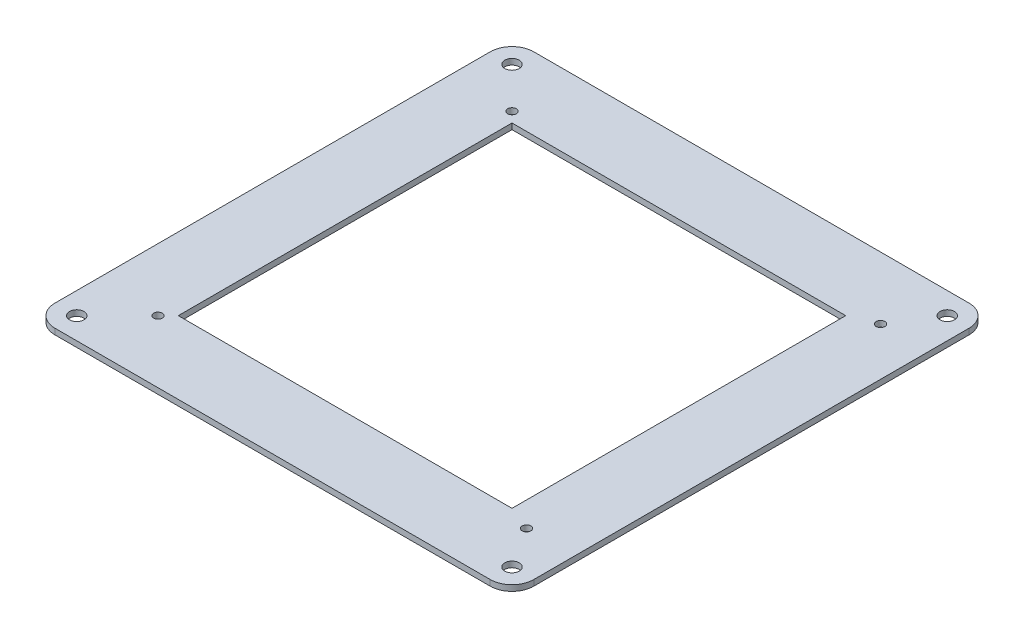
from build123d import *

# Parameters (mm, degrees)
CROQUIS1_W              = 170
CROQUIS1_H              = 170
CROQUIS1_R              = 2.5
CROQUIS1_R_2            = 1.5
CROQUIS1_W_2            = 115
CROQUIS1_H_2            = 115
SALIENTE_EXTRUIR1_DEPTH = 2
CROQUIS3_W              = 170
CROQUIS3_H              = 170
CORTAR_EXTRUIR1_DEPTH   = 10


with BuildPart() as part:
    # Croquis1 → Saliente-Extruir1 (new body)
    with BuildSketch(Plane(origin=(0, 0, 0), x_dir=(1, 0, 0), z_dir=(0, 1, 0))):
        Rectangle(CROQUIS1_W, CROQUIS1_H)
        with Locations(Location((-75, 75, 0), (0, 0, 270))):
            Circle(CROQUIS1_R, mode=Mode.SUBTRACT)
        with Locations(Location((75, 75, 0), (0, 0, 270))):
            Circle(CROQUIS1_R, mode=Mode.SUBTRACT)
        with Locations(Location((75, -75, 0), (0, 0, 270))):
            Circle(CROQUIS1_R, mode=Mode.SUBTRACT)
        with Locations(Location((-75, -75, 0), (0, 0, 270))):
            Circle(CROQUIS1_R, mode=Mode.SUBTRACT)
        with Locations(Location((-61, 61, 0), (0, 0, 270))):
            Circle(CROQUIS1_R_2, mode=Mode.SUBTRACT)
        with Locations(Location((66, 61, 0), (0, 0, 270))):
            Circle(CROQUIS1_R_2, mode=Mode.SUBTRACT)
        with Locations(Location((66, -61, 0), (0, 0, 270))):
            Circle(CROQUIS1_R_2, mode=Mode.SUBTRACT)
        with Locations(Location((-61, -61, 0), (0, 0, 270))):
            Circle(CROQUIS1_R_2, mode=Mode.SUBTRACT)
        Rectangle(CROQUIS1_W_2, CROQUIS1_H_2, mode=Mode.SUBTRACT)
    extrude(amount=SALIENTE_EXTRUIR1_DEPTH)

    # Croquis3 → Cortar-Extruir1 (cut)
    with BuildSketch(Plane(origin=(0, 2, 0), x_dir=(1, 0, 0), z_dir=(0, 1, 0))):
        Rectangle(CROQUIS3_W, CROQUIS3_H)
        with BuildLine():
            Line((75, -82.5), (-75, -82.5))
            ThreePointArc((-75, -82.5), (-80.303300859, -80.303300859), (-82.5, -75))
            Line((-82.5, -75), (-82.5, 75))
            ThreePointArc((-82.5, 75), (-80.303300859, 80.303300859), (-75, 82.5))
            Line((-75, 82.5), (75, 82.5))
            ThreePointArc((75, 82.5), (80.303300859, 80.303300859), (82.5, 75))
            Line((82.5, 75), (82.5, -75))
            ThreePointArc((82.5, -75), (80.303300859, -80.303300859), (75, -82.5))
        make_face(mode=Mode.SUBTRACT)
    extrude(amount=-CORTAR_EXTRUIR1_DEPTH, mode=Mode.SUBTRACT)


solid = part.part
